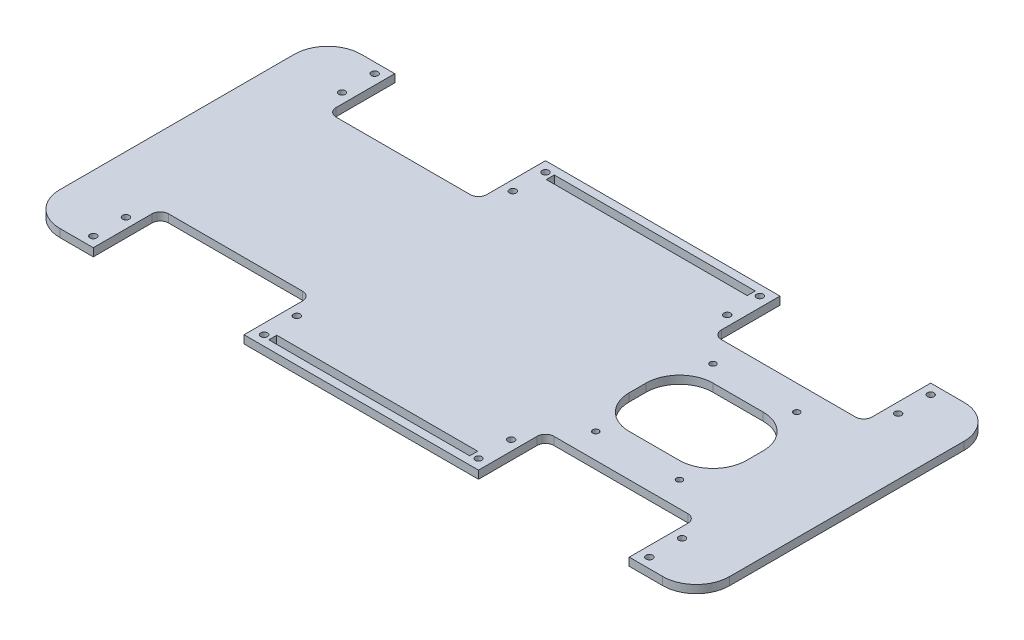
from build123d import *

# Parameters (mm, degrees)
BOSS_EXTRUDE1_DEPTH      = 2.38125
M3_CLEARANCE_HOLE1_D     = 3.6
M3_CLEARANCE_HOLE1_DEPTH = 10
M3_CLEARANCE_HOLE1_TIP   = 1.081549114
SKETCH5_W                = 120
SKETCH5_H                = 4.7625
CUT_EXTRUDE1_DEPTH       = 10
SKETCH6_R                = 2
CUT_EXTRUDE2_DEPTH       = 10
SKETCH7_W                = 70
SKETCH7_H                = 50
CUT_EXTRUDE3_DEPTH       = 10
FILLET1_R                = 20
FILLET2_R                = 5


with BuildPart() as part:
    # Sketch1 → Boss-Extrude1 (new, symmetric)
    with BuildSketch(Plane(origin=(0, 0, 0), x_dir=(1, 0, 0), z_dir=(0, 1, 0))):
        Polygon((-200, 90), (-160, 90), (-160, 50), (-70, 50), (-70, 90), (70, 90), (70, 50), (160, 50), (160, 90), (200, 90), (200, -90), (160, -90), (160, -50), (70, -50), (70, -90), (-70, -90), (-70, -50), (-160, -50), (-160, -90), (-200, -90), align=None)
    extrude(amount=BOSS_EXTRUDE1_DEPTH, both=True)

    # M3 Clearance Hole1
    with Locations(Plane(origin=(0, 2.38125, 0), x_dir=(1, 0, 0), z_dir=(0, 1, 0))):
        with Locations((135, -35), (85, -35), (85, 35), (135, 35)):
            Hole(M3_CLEARANCE_HOLE1_D / 2, depth=M3_CLEARANCE_HOLE1_DEPTH)
            with Locations((0, 0, -(M3_CLEARANCE_HOLE1_DEPTH + M3_CLEARANCE_HOLE1_TIP / 2))):  # 118° drill point
                Cone(0, M3_CLEARANCE_HOLE1_D / 2, M3_CLEARANCE_HOLE1_TIP, mode=Mode.SUBTRACT)

    # Sketch5 → Cut-Extrude1 (cut)
    with BuildSketch(Plane(origin=(0, 2.38125, 0), x_dir=(1, 0, 0), z_dir=(0, 1, 0))):
        with Locations((0, 82.85625)):
            Rectangle(SKETCH5_W, SKETCH5_H)
        with Locations((0, -82.85625)):
            Rectangle(SKETCH5_W, SKETCH5_H)
    extrude(amount=-CUT_EXTRUDE1_DEPTH, mode=Mode.SUBTRACT)

    # Sketch6 → Cut-Extrude2 (cut)
    with BuildSketch(Plane.XZ.offset(2.38125)):
        with Locations(Location((-166, 84, 0), (0, 0, 270))):
            Circle(SKETCH6_R)
        with Locations(Location((-166, 64.5, 0), (0, 0, 270))):
            Circle(SKETCH6_R)
        with Locations(Location((-64, 84, 0), (0, 0, 270))):
            Circle(SKETCH6_R)
        with Locations(Location((-64, 64.5, 0), (0, 0, 270))):
            Circle(SKETCH6_R)
        with Locations(Location((-166, -64.5, 0), (0, 0, 270))):
            Circle(SKETCH6_R)
        with Locations(Location((-166, -84, 0), (0, 0, 270))):
            Circle(SKETCH6_R)
        with Locations(Location((-64, -64.5, 0), (0, 0, 270))):
            Circle(SKETCH6_R)
        with Locations(Location((-64, -84, 0), (0, 0, 270))):
            Circle(SKETCH6_R)
    cut_extrude2 = extrude(amount=-CUT_EXTRUDE2_DEPTH, mode=Mode.SUBTRACT)

    # Mirror1: Cut-Extrude2 across plane
    add(cut_extrude2.mirror(Plane.ZY), mode=Mode.SUBTRACT)

    # Sketch7 → Cut-Extrude3 (cut)
    with BuildSketch(Plane(origin=(0, 2.38125, 0), x_dir=(1, 0, 0), z_dir=(0, 1, 0))):
        with Locations((110, 0)):
            Rectangle(SKETCH7_W, SKETCH7_H)
    extrude(amount=-CUT_EXTRUDE3_DEPTH, mode=Mode.SUBTRACT)

    # Fillet1
    fillet1_edges = [part.edges().sort_by_distance(p)[0] for p in [
        (75, 0, 25),
        (75, 0, -25),
        (145, 0, -25),
        (145, 0, 25),
        (-200, 0, -90),
        (200, 0, -90),
        (200, 0, 90),
        (-200, 0, 90),
    ]]
    fillet(fillet1_edges, radius=FILLET1_R)

    # Fillet2
    fillet2_edges = [part.edges().sort_by_distance(p)[0] for p in [
        (-160, 0, -50),
        (-70, 0, -50),
        (70, 0, -50),
        (160, 0, -50),
        (160, 0, 50),
        (70, 0, 50),
        (-70, 0, 50),
        (-160, 0, 50),
    ]]
    fillet(fillet2_edges, radius=FILLET2_R)


solid = part.part
